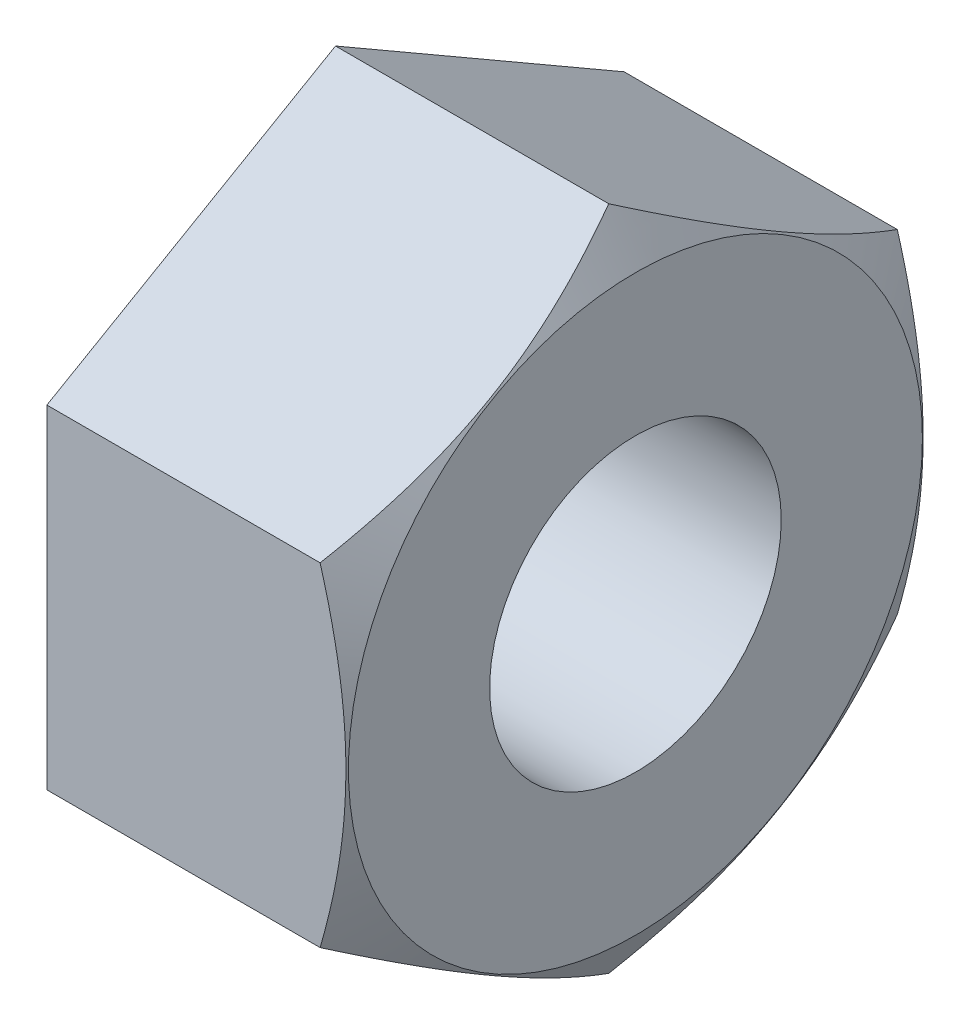
from build123d import *

# Parameters (mm, degrees)
BOSS_EXTRUDE1_DEPTH = 21.6
SKETCH2_OUTSIDE_W   = 131.808
SKETCH2_OUTSIDE_H   = 138.238
SKETCH2_OUTSIDE_R   = 20.667093795
CUT_EXTRUDE2_DEPTH  = 21.6
CUT_EXTRUDE2_DRAFT  = -60
M24_TAPPED_HOLE1_D  = 21


with BuildPart() as part:
    # Sketch1 → Boss-Extrude1 (new body)
    with BuildSketch(Plane(origin=(0, 0, 0), x_dir=(0, 0, -1), z_dir=(1, 0, 0))):
        Polygon((0, -24), (20.784609691, -12), (20.784609691, 12), (0, 24), (-20.784609691, 12), (-20.784609691, -12), align=None)
    extrude(amount=BOSS_EXTRUDE1_DEPTH)


with BuildPart() as cut_extrude2_tool:
    # Sketch2 outside → Cut-Extrude2 (with draft: the straight prism first)
    with BuildSketch(Plane(origin=(21.6, 0, 0), x_dir=(0, 0, -1), z_dir=(1, 0, 0))):
        Rectangle(SKETCH2_OUTSIDE_W, SKETCH2_OUTSIDE_H)
        Circle(SKETCH2_OUTSIDE_R, mode=Mode.SUBTRACT)
    extrude(amount=-CUT_EXTRUDE2_DEPTH)
    # Cut-Extrude2: the draft: its side faces are tilted about the plane it starts from
    cut_extrude2_sides = [cut_extrude2_tool.faces().sort_by_distance(p)[0] for p in [
        (10.8, -69.119, 0),
        (10.8, 0, -65.904),
        (10.8, 69.119, 0),
        (10.8, 0, 65.904),
        (10.8, 0, 20.667093795),
    ]]
    draft(cut_extrude2_sides, Plane(origin=(21.6, 0, 0), x_dir=(0, 0, -1), z_dir=(1, 0, 0)), CUT_EXTRUDE2_DRAFT)


with BuildPart() as part_1:
    add(part.part)

    # Cut-Extrude2: cut by cut_extrude2_tool
    add(cut_extrude2_tool.part, mode=Mode.SUBTRACT)

    # M24 Tapped Hole1 (through all)
    with Locations(Plane(origin=(21.6, 0, 0), x_dir=(0, 0, -1), z_dir=(1, 0, 0))):
        with Locations((0, 0)):
            Hole(M24_TAPPED_HOLE1_D / 2)


solid = part_1.part
